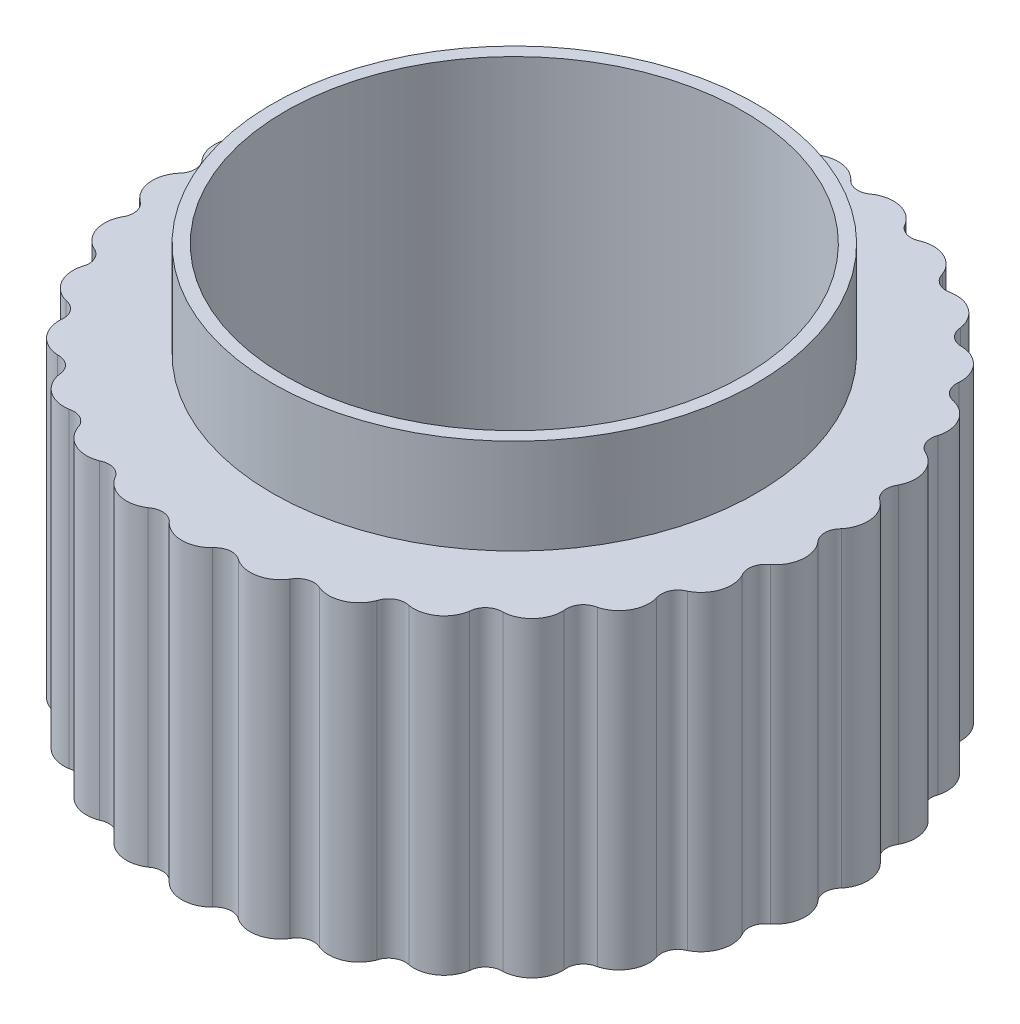
from build123d import *

# Parameters (mm, degrees)
SKETCH7_R                = 27.493094195
BOSS_EXTRUDE2_DEPTH      = 36
BOSS_EXTRUDE3_DEPTH      = 11
BOSS_EXTRUDE3_DEPTH_BACK = 36
SKETCH8_R                = 27.992837321
SKETCH8_R_2              = 26.502402217


with BuildPart() as part:
    # Sketch7 → Boss-Extrude2 (new body)
    with BuildSketch(Plane(origin=(0, 195, 0), x_dir=(1, 0, 0), z_dir=(0, 1, 0))):
        with BuildLine():
            ThreePointArc((469.000007042, -36.915443923), (471.500007042, -37.950977828), (474.000007042, -36.915443923))
            ThreePointArc((474.000007042, -36.915443923), (475.305477345, -36.206631381), (476.729790403, -36.62853213))
            ThreePointArc((476.729790403, -36.62853213), (479.390459011, -37.121657908), (481.620528407, -35.588973676))
            ThreePointArc((481.620528407, -35.588973676), (482.750100638, -34.624227851), (484.231007137, -34.74077772))
            ThreePointArc((484.231007137, -34.74077772), (486.936060365, -34.669943408), (488.798734425, -32.707094505))
            ThreePointArc((488.798734425, -32.707094505), (489.703040856, -31.528579418), (491.175818076, -31.334684619))
            ThreePointArc((491.175818076, -31.334684619), (493.80703212, -30.702986016), (495.220903048, -28.395758358))
            ThreePointArc((495.220903048, -28.395758358), (495.86042115, -27.054980774), (497.260701657, -26.55911544))
            ThreePointArc((497.260701657, -26.55911544), (499.703079837, -25.394160806), (500.606354689, -22.843391312))
            ThreePointArc((500.606354689, -22.843391312), (500.953134452, -21.398949646), (502.219719271, -20.622785471))
            ThreePointArc((502.219719271, -20.622785471), (504.36651794, -18.975488914), (504.719719271, -16.292658452))
            ThreePointArc((504.719719271, -16.292658452), (504.758604755, -14.807681735), (505.836138051, -13.785140818))
            ThreePointArc((505.836138051, -13.785140818), (507.593531806, -11.727497102), (507.381223022, -9.029858236))
            ThreePointArc((507.381223022, -9.029858236), (507.110514745, -7.569247077), (507.951903142, -6.345019362))
            ThreePointArc((507.951903142, -6.345019362), (509.243085443, -3.966957392), (508.474545458, -1.372409886))
            ThreePointArc((508.474545458, -1.372409886), (507.906074671, 0), (508.474545458, 1.372409886))
            ThreePointArc((508.474545458, 1.372409886), (509.243085443, 3.966957392), (507.951903142, 6.345019362))
            ThreePointArc((507.951903142, 6.345019362), (507.110514745, 7.569247077), (507.381223022, 9.029858236))
            ThreePointArc((507.381223022, 9.029858236), (507.593531806, 11.727497102), (505.836138051, 13.785140818))
            ThreePointArc((505.836138051, 13.785140818), (504.758604755, 14.807681735), (504.719719271, 16.292658452))
            ThreePointArc((504.719719271, 16.292658452), (504.36651794, 18.975488914), (502.219719271, 20.622785471))
            ThreePointArc((502.219719271, 20.622785471), (500.953134452, 21.398949646), (500.606354689, 22.843391312))
            ThreePointArc((500.606354689, 22.843391312), (499.703079837, 25.394160806), (497.260701657, 26.55911544))
            ThreePointArc((497.260701657, 26.55911544), (495.86042115, 27.054980774), (495.220903048, 28.395758358))
            ThreePointArc((495.220903048, 28.395758358), (493.80703212, 30.702986016), (491.175818076, 31.334684619))
            ThreePointArc((491.175818076, 31.334684619), (489.703040856, 31.528579418), (488.798734425, 32.707094505))
            ThreePointArc((488.798734425, 32.707094505), (486.936060365, 34.669943408), (484.231007137, 34.74077772))
            ThreePointArc((484.231007137, 34.74077772), (482.750100638, 34.624227851), (481.620528407, 35.588973676))
            ThreePointArc((481.620528407, 35.588973676), (479.390459011, 37.121657908), (476.729790403, 36.62853213))
            ThreePointArc((476.729790403, 36.62853213), (475.305477345, 36.206631381), (474.000007042, 36.915443923))
            ThreePointArc((474.000007042, 36.915443923), (471.500007042, 37.950977828), (469.000007042, 36.915443923))
            ThreePointArc((469.000007042, 36.915443923), (467.694536739, 36.206631381), (466.270223681, 36.62853213))
            ThreePointArc((466.270223681, 36.62853213), (463.609555074, 37.121657908), (461.379485677, 35.588973676))
            ThreePointArc((461.379485677, 35.588973676), (460.249913446, 34.624227851), (458.769006947, 34.74077772))
            ThreePointArc((458.769006947, 34.74077772), (456.063953719, 34.669943408), (454.201279659, 32.707094505))
            ThreePointArc((454.201279659, 32.707094505), (453.296973228, 31.528579418), (451.824196008, 31.334684619))
            ThreePointArc((451.824196008, 31.334684619), (449.192981964, 30.702986016), (447.779111037, 28.395758358))
            ThreePointArc((447.779111037, 28.395758358), (447.139592935, 27.054980774), (445.739312427, 26.55911544))
            ThreePointArc((445.739312427, 26.55911544), (443.296934247, 25.394160806), (442.393659395, 22.843391312))
            ThreePointArc((442.393659395, 22.843391312), (442.046879632, 21.398949646), (440.780294813, 20.622785471))
            ThreePointArc((440.780294813, 20.622785471), (438.633496144, 18.975488914), (438.280294813, 16.292658452))
            ThreePointArc((438.280294813, 16.292658452), (438.241409329, 14.807681735), (437.163876034, 13.785140818))
            ThreePointArc((437.163876034, 13.785140818), (435.406482279, 11.727497102), (435.618791062, 9.029858236))
            ThreePointArc((435.618791062, 9.029858236), (435.889499339, 7.569247077), (435.048110942, 6.345019362))
            ThreePointArc((435.048110942, 6.345019362), (433.756928641, 3.966957392), (434.525468626, 1.372409886))
            ThreePointArc((434.525468626, 1.372409886), (435.093939413, 0), (434.525468626, -1.372409886))
            ThreePointArc((434.525468626, -1.372409886), (433.756928641, -3.966957392), (435.048110942, -6.345019362))
            ThreePointArc((435.048110942, -6.345019362), (435.889499339, -7.569247077), (435.618791062, -9.029858236))
            ThreePointArc((435.618791062, -9.029858236), (435.406482279, -11.727497102), (437.163876034, -13.785140818))
            ThreePointArc((437.163876034, -13.785140818), (438.241409329, -14.807681735), (438.280294813, -16.292658452))
            ThreePointArc((438.280294813, -16.292658452), (438.633496144, -18.975488914), (440.780294813, -20.622785471))
            ThreePointArc((440.780294813, -20.622785471), (442.046879632, -21.398949646), (442.393659395, -22.843391312))
            ThreePointArc((442.393659395, -22.843391312), (443.296934247, -25.394160806), (445.739312427, -26.55911544))
            ThreePointArc((445.739312427, -26.55911544), (447.139592935, -27.054980774), (447.779111037, -28.395758358))
            ThreePointArc((447.779111037, -28.395758358), (449.192981964, -30.702986016), (451.824196008, -31.334684619))
            ThreePointArc((451.824196008, -31.334684619), (453.296973228, -31.528579418), (454.201279659, -32.707094505))
            ThreePointArc((454.201279659, -32.707094505), (456.063953719, -34.669943408), (458.769006947, -34.74077772))
            ThreePointArc((458.769006947, -34.74077772), (460.249913446, -34.624227851), (461.379485677, -35.588973676))
            ThreePointArc((461.379485677, -35.588973676), (463.609555074, -37.121657908), (466.270223681, -36.62853213))
            ThreePointArc((466.270223681, -36.62853213), (467.694536739, -36.206631381), (469.000007042, -36.915443923))
        make_face()
        with Locations(Location((471.500007042, 0, 0), (0, 0, 270))):
            Circle(SKETCH7_R, mode=Mode.SUBTRACT)
    extrude(amount=-BOSS_EXTRUDE2_DEPTH)

    # Sketch8 → Boss-Extrude3 (add, two sides: drawn at the far end of the back side and taken through both)
    with BuildSketch(Plane(origin=(0, 195, 0), x_dir=(1, 0, 0), z_dir=(0, 1, 0)).offset(-BOSS_EXTRUDE3_DEPTH_BACK)):
        with Locations(Location((471.999750168, 0, 0), (0, 0, 270))):
            Circle(SKETCH8_R)
        with Locations(Location((471.999750168, 0, 0), (0, 0, 270))):
            Circle(SKETCH8_R_2, mode=Mode.SUBTRACT)
    extrude(amount=BOSS_EXTRUDE3_DEPTH + BOSS_EXTRUDE3_DEPTH_BACK)


solid = part.part
